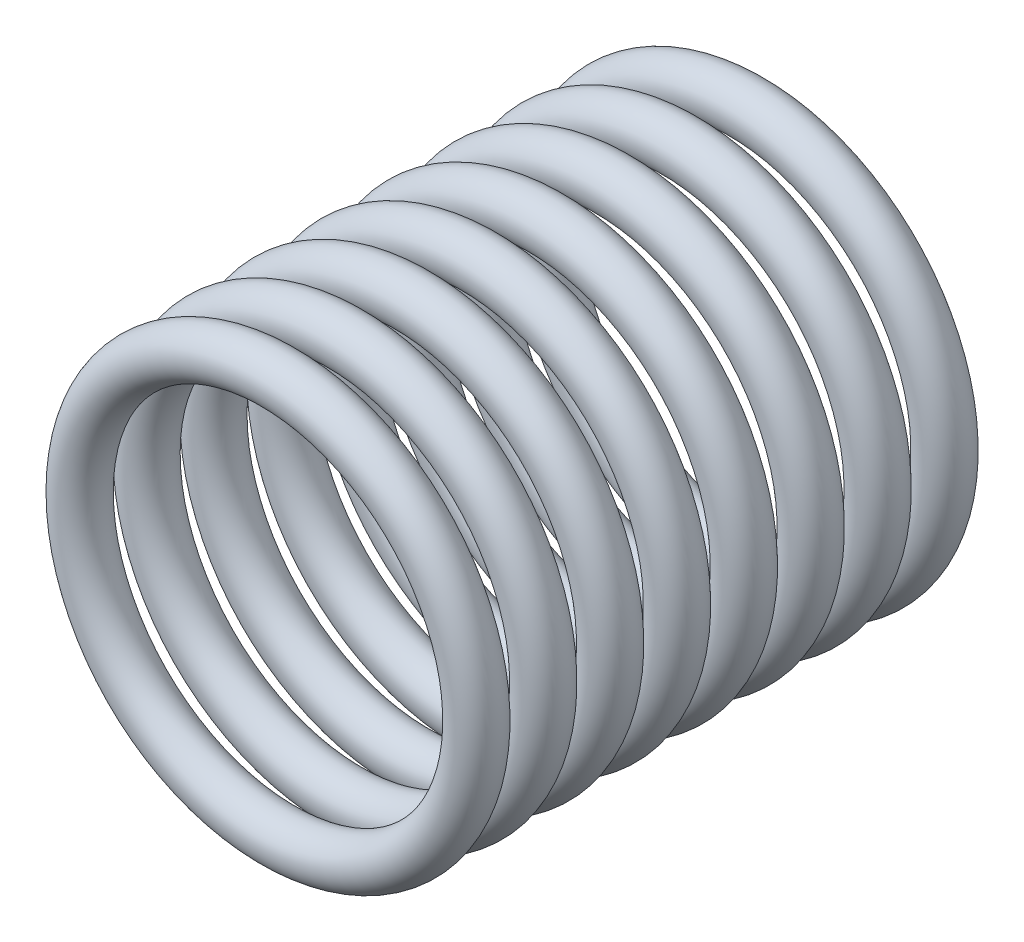
from build123d import *

# Parameters (mm, degrees)
SKETCH_1_R = 0.6


with BuildPart() as part:
    # 草图1 → 旋转1 (revolve)
    with BuildSketch(Plane(origin=(0, 0, 0), x_dir=(1, 0, 0), z_dir=(0, 1, 0)), mode=Mode.PRIVATE) as revolve_1_sk:
        with Locations((5, -0.6)):
            Circle(SKETCH_1_R)
        with Locations((5, -2.2857)):
            Circle(SKETCH_1_R)
        with Locations((5, -3.9714)):
            Circle(SKETCH_1_R)
        with Locations((5, -5.6571)):
            Circle(SKETCH_1_R)
        with Locations((5, -7.3429)):
            Circle(SKETCH_1_R)
        with Locations((5, -9.0286)):
            Circle(SKETCH_1_R)
        with Locations((5, -10.7143)):
            Circle(SKETCH_1_R)
        with Locations((5, -12.4)):
            Circle(SKETCH_1_R)
    revolve(revolve_1_sk.sketch.rotate(Axis((0, 0, 0), (0, 0, 1)), 180), axis=Axis((0, 0, 0), (0, 0, 1)))


solid = part.part
